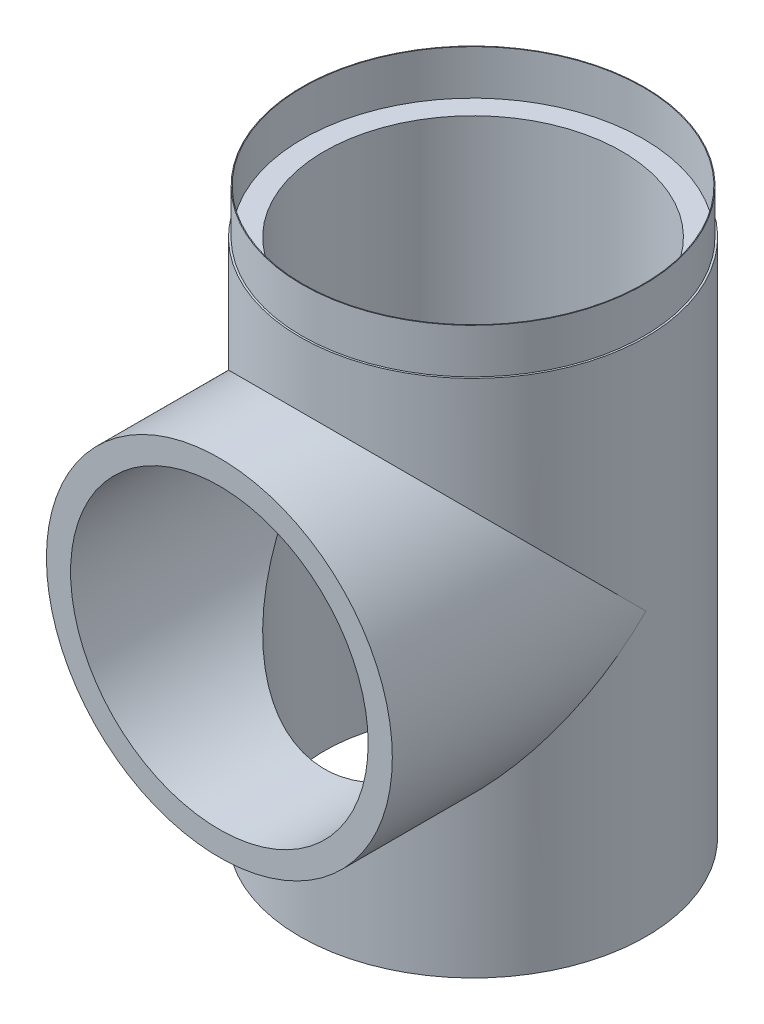
from build123d import *

# Parameters (mm, degrees)
SKETCH_1_R          = 232.5
SKETCH_1_R_2        = 200
EXTRUDE_1_DEPTH     = 698
SKETCH_11_R         = 230
SKETCH_11_R_2       = 229
EXTRUDE_1_2_DEPTH   = 60
SKETCH_12_R         = 232.5
SKETCH_12_R_2       = 200
EXTRUDE_2_DEPTH     = 341
SKETCH_13_R         = 200
CUT_EXTRUDE_1_DEPTH = 380
CUT_EXTRUDE_START   = -1000
SKETCH_14_R         = 200
CUT_EXTRUDE_2_DEPTH = 1000


with BuildPart() as part:
    # Эскиз1 → Extrude 1 (new body)
    with BuildSketch(Plane(origin=(0, 0, 0), x_dir=(1, 0, 0), z_dir=(0, 1, 0))):
        with Locations(Location((0, 0, 0), (0, 0, 270))):
            Circle(SKETCH_1_R)
        with Locations(Location((0, 0, 0), (0, 0, 270))):
            Circle(SKETCH_1_R_2, mode=Mode.SUBTRACT)
    extrude(amount=EXTRUDE_1_DEPTH)

    # Эскиз11 → Extrude 1 2 (add)
    with BuildSketch(Plane(origin=(0, 698, 0), x_dir=(1, 0, 0), z_dir=(0, 1, 0))):
        with Locations(Location((0, 0, 0), (0, 0, 270))):
            Circle(SKETCH_11_R)
        with Locations(Location((0, 0, 0), (0, 0, 270))):
            Circle(SKETCH_11_R_2, mode=Mode.SUBTRACT)
    extrude(amount=EXTRUDE_1_2_DEPTH)

    # Эскиз12 → Бобышка-Вытянуть2 (add)
    with BuildSketch(Plane.XY):
        with Locations((0, 379)):
            Circle(SKETCH_12_R)
        with Locations(Location((0, 379, 0), (0, 0, 180))):
            Circle(SKETCH_12_R_2, mode=Mode.SUBTRACT)
    extrude(amount=EXTRUDE_2_DEPTH)

    # Эскиз13 → Вырез-Вытянуть1 (cut)
    with BuildSketch(Plane.XY):
        with Locations((0, 379)):
            Circle(SKETCH_13_R)
    extrude(amount=CUT_EXTRUDE_1_DEPTH, mode=Mode.SUBTRACT)

    # Эскиз14 → Вырез-Вытянуть2 (cut)
    with BuildSketch(Plane(origin=(0, 698, 0), x_dir=(1, 0, 0), z_dir=(0, 1, 0)).offset(CUT_EXTRUDE_START)):
        with Locations(Location((0, 0, 0), (0, 0, 270))):
            Circle(SKETCH_14_R)
    extrude(amount=CUT_EXTRUDE_2_DEPTH, mode=Mode.SUBTRACT)


solid = part.part
